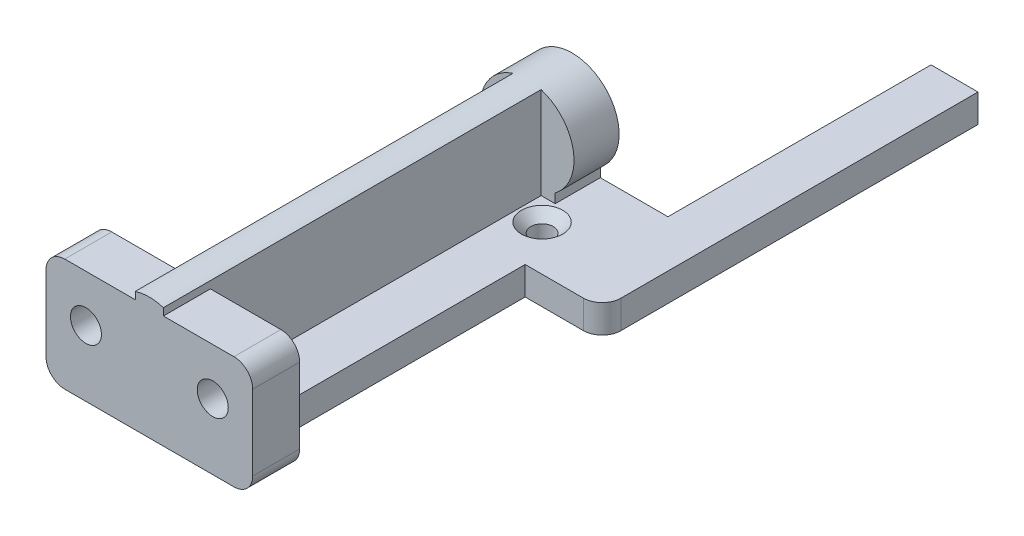
from build123d import *

# Parameters (mm, degrees)
SKETCH1_R                                           = 1.15
BOSS_EXTRUDE1_DEPTH                                 = 3
BOSS_EXTRUDE3_DEPTH                                 = 10
CSK_FOR_M2_COUNTERSUNK_FLAT_HEAD_SCREW2_D           = 2.4
CSK_FOR_M2_COUNTERSUNK_FLAT_HEAD_SCREW2_CSINK_D     = 4.4
CSK_FOR_M2_COUNTERSUNK_FLAT_HEAD_SCREW2_CSINK_ANGLE = 90
CUT_EXTRUDE2_DEPTH                                  = 50.244695146
SKETCH1_4_W                                         = 22
SKETCH1_4_H                                         = 5
BOSS_EXTRUDE4_DEPTH                                 = 12
SKETCH7_R                                           = 1.65
CUT_EXTRUDE3_DEPTH                                  = 71.880462752
CUT_EXTRUDE4_DEPTH                                  = 2.5
FILLET2_R                                           = 2


with BuildPart() as part:
    # Sketch1 → Boss-Extrude1 (new body)
    with BuildSketch(Plane(origin=(0, 0, 0), x_dir=(1, 0, 0), z_dir=(0, 1, 0))):
        Polygon((7, -6), (15.2, -6), (15.2, 34), (10.2, 34), (10.2, 6), (-7, 6), (-7, -39), (7, -39), align=None)
        with Locations((4, -1.2)):
            Circle(SKETCH1_R, mode=Mode.SUBTRACT)
        with Locations((-4, -1.2)):
            Circle(SKETCH1_R, mode=Mode.SUBTRACT)
    extrude(amount=BOSS_EXTRUDE1_DEPTH)

    # Sketch3 → Boss-Extrude3 (add)
    with BuildSketch(Plane(origin=(0, 3, 0), x_dir=(1, 0, 0), z_dir=(0, 1, 0))):
        Polygon((-5, 1.2), (-1.5, 1.2), (-1.5, -39), (1.5, -39), (1.5, 1.2), (5, 1.2), (5, 6), (-5, 6), align=None)
    extrude(amount=BOSS_EXTRUDE3_DEPTH)

    # CSK for M2 Countersunk Flat Head Screw2 (through all)
    with Locations(Plane(origin=(-4, 3, 1.2), x_dir=(0, 0, 1), z_dir=(0, 1, 0))):
        with Locations((0, 0), (0, 8)):
            CounterSinkHole(CSK_FOR_M2_COUNTERSUNK_FLAT_HEAD_SCREW2_D / 2, CSK_FOR_M2_COUNTERSUNK_FLAT_HEAD_SCREW2_CSINK_D / 2, counter_sink_angle=CSK_FOR_M2_COUNTERSUNK_FLAT_HEAD_SCREW2_CSINK_ANGLE)

    # Sketch6 → Cut-Extrude2 (cut, through all)
    with BuildSketch(Plane(origin=(0, 0, -6), x_dir=(-1, 0, 0), z_dir=(0, 0, -1))):
        with BuildLine():
            Line((-5, 3), (-3, 3))
            Line((-3, 3), (-3, 4))
            ThreePointArc((-3, 4), (-4.472135952, 5.763932017), (-5, 7.999999988))
            Line((-5, 7.999999988), (-5, 3))
        make_face()
        with BuildLine():
            Line((5, 3), (5, 8))
            ThreePointArc((5, 8), (4.472135955, 5.763932023), (3, 4))
            Line((3, 4), (3, 3))
            Line((3, 3), (5, 3))
        make_face()
        with BuildLine():
            Line((5, 13), (0, 13))
            ThreePointArc((0, 13), (3.535533906, 11.535533906), (5, 8))
            Line((5, 8), (5, 13))
        make_face()
        with BuildLine():
            Line((-5, 13), (-5, 7.999999988))
            ThreePointArc((-5, 7.999999988), (-3.53553391, 11.535533902), (0, 13))
            Line((0, 13), (-5, 13))
        make_face()
    extrude(amount=-CUT_EXTRUDE2_DEPTH, mode=Mode.SUBTRACT)

    # Sketch1<4> → Boss-Extrude4 (add)
    with BuildSketch(Plane(origin=(0, 0, 0), x_dir=(1, 0, 0), z_dir=(0, 1, 0))):
        with Locations((0, -36.5)):
            Rectangle(SKETCH1_4_W, SKETCH1_4_H)
    extrude(amount=BOSS_EXTRUDE4_DEPTH)

    # Sketch7 → Cut-Extrude3 (cut, through all)
    with BuildSketch(Plane(origin=(0, 0, 34), x_dir=(-1, 0, 0), z_dir=(0, 0, -1))):
        with Locations((6.75, 7)):
            Circle(SKETCH7_R)
        with Locations((-6.75, 7)):
            Circle(SKETCH7_R)
    extrude(amount=-CUT_EXTRUDE3_DEPTH, mode=Mode.SUBTRACT)

    # Sketch7<3> → Cut-Extrude4 (cut)
    with BuildSketch(Plane(origin=(0, 0, 34), x_dir=(-1, 0, 0), z_dir=(0, 0, -1))):
        Polygon((5.16228676, 9.75), (3.574573519, 7), (5.16228676, 4.25), (8.33771324, 4.25), (9.925426481, 7), (8.33771324, 9.75), align=None)
        Polygon((-5.16228676, 9.75), (-3.574573519, 7), (-5.16228676, 4.25), (-8.33771324, 4.25), (-9.925426481, 7), (-8.33771324, 9.75), align=None)
    extrude(amount=-CUT_EXTRUDE4_DEPTH, mode=Mode.SUBTRACT)

    # Fillet2
    fillet2_edges = [part.edges().sort_by_distance(p)[0] for p in [
        (15.2, 1.5, 6),
        (-11, 12, 36.5),
        (-11, 0, 36.5),
        (11, 0, 36.5),
        (11, 12, 36.5),
    ]]
    fillet(fillet2_edges, radius=FILLET2_R)


solid = part.part
